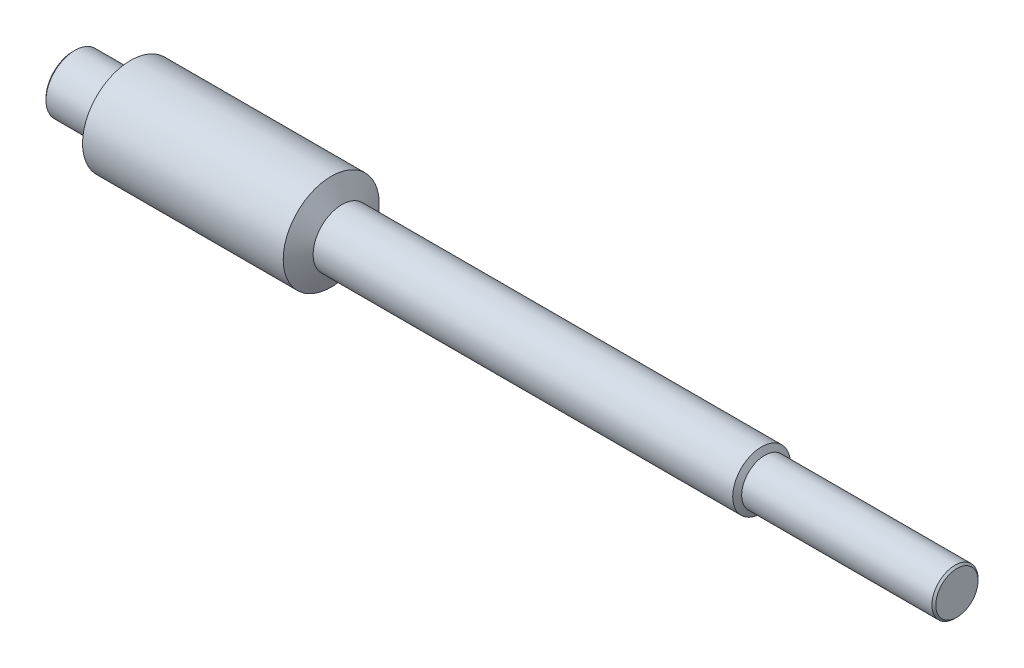
from build123d import *

# Parameters (mm, degrees)
OTW_R_GWINTOWANY_M81_D     = 6.8
OTW_R_GWINTOWANY_M81_DEPTH = 12.25
OTW_R_GWINTOWANY_M81_TIP   = 2.042926105
SFAZOWANIE1_SIZE           = 1
SFAZOWANIE2_SIZE           = 1


with BuildPart() as part:
    # Szkic1 → Obrót1 (revolve)
    with BuildSketch(Plane.XY, mode=Mode.PRIVATE) as obr_t1_sk:
        Polygon((-133.522258266, 0), (-133.522258266, 15), (-106.522258266, 15), (-106.522258266, 14), (-103.522258266, 14), (-103.522258266, 25), (0.919675372, 25), (6.477741734, 15), (224.810321825, 15), (226.477741734, 12), (326.477741734, 12), (326.477741734, 0), align=None)
    revolve(obr_t1_sk.sketch.rotate(Axis((-73.178837214, 0, 0), (1, 0, 0)), 90), axis=Axis((-73.178837214, 0, 0), (1, 0, 0)))

    # Otwór gwintowany M81
    with Locations(Plane.ZY.offset(133.522258266)):
        with Locations((0, 0)):
            Hole(OTW_R_GWINTOWANY_M81_D / 2, depth=OTW_R_GWINTOWANY_M81_DEPTH)
            with Locations((0, 0, -(OTW_R_GWINTOWANY_M81_DEPTH + OTW_R_GWINTOWANY_M81_TIP / 2))):  # 118° drill point
                Cone(0, OTW_R_GWINTOWANY_M81_D / 2, OTW_R_GWINTOWANY_M81_TIP, mode=Mode.SUBTRACT)

    # Sfazowanie1
    sfazowanie1_edges = [part.edges().sort_by_distance(p)[0] for p in [
        (-133.522258266, 0, -15),
    ]]
    chamfer(sfazowanie1_edges, length=SFAZOWANIE1_SIZE)

    # Sfazowanie2
    sfazowanie2_edges = [part.edges().sort_by_distance(p)[0] for p in [
        (326.477741734, 0, -12),
    ]]
    chamfer(sfazowanie2_edges, length=SFAZOWANIE2_SIZE)


solid = part.part
